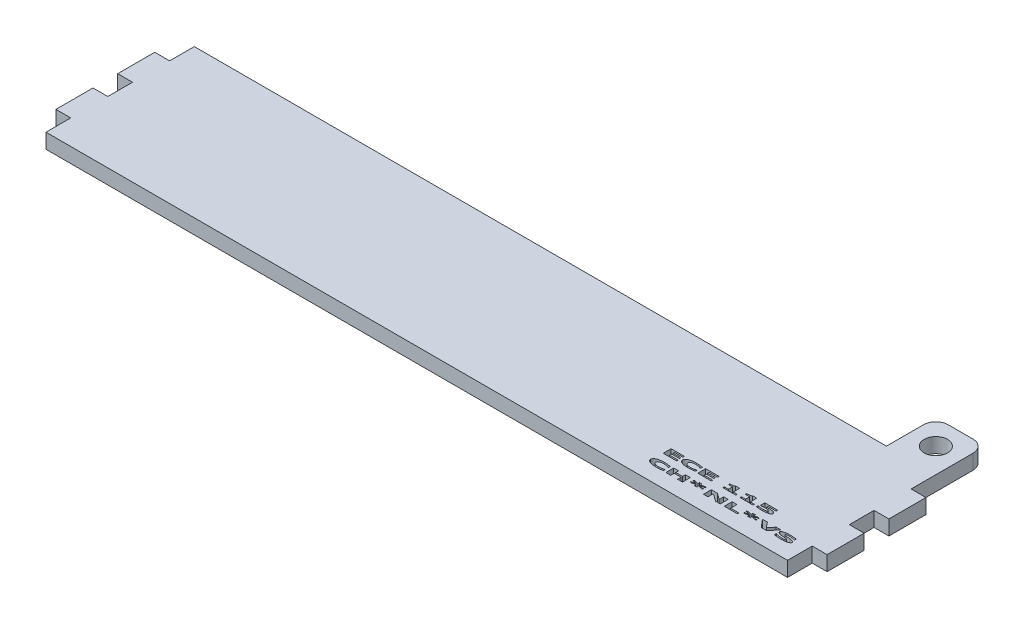
from build123d import *

# Parameters (mm, degrees)
BOSS_EXTRUDE1_DEPTH = 6
SKETCH2_R           = 4.75
CUT_EXTRUDE1_DEPTH  = 6
FILLET2_R           = 5
CUT_EXTRUDE2_DEPTH  = 10


with BuildPart() as part:
    # Sketch1 → Boss-Extrude1 (new body)
    with BuildSketch(Plane(origin=(0, 0, 0), x_dir=(1, 0, 0), z_dir=(0, 1, 0))):
        Polygon((-153.92896215, 40.606901786), (-153.92896215, 30.606901786), (-159.92896215, 30.606901786), (-159.92896215, 15.606901786), (-153.92896215, 15.606901786), (-153.92896215, 5.606901786), (146.07103785, 5.606901786), (146.07103785, 15.606901786), (152.07103785, 15.606901786), (152.07103785, 30.606901786), (146.07103785, 30.606901786), (146.07103785, 40.606901786), (152.07103785, 40.606901786), (152.07103785, 55.606901786), (146.07103785, 55.606901786), (146.07103785, 65.606901786), (146.07103785, 85.606901786), (126.07103785, 85.606901786), (126.07103785, 65.606901786), (-153.92896215, 65.606901786), (-153.92896215, 55.606901786), (-159.92896215, 55.606901786), (-159.92896215, 40.606901786), align=None)
    extrude(amount=BOSS_EXTRUDE1_DEPTH)

    # Sketch2 → Cut-Extrude1 (cut)
    with BuildSketch(Plane(origin=(0, 6, 0), x_dir=(1, 0, 0), z_dir=(0, 1, 0))):
        with Locations(Location((136.07103785, 75.606901786, 0), (0, 0, 270))):
            Circle(SKETCH2_R)
    extrude(amount=-CUT_EXTRUDE1_DEPTH, mode=Mode.SUBTRACT)

    # Fillet2
    fillet2_edges = [part.edges().sort_by_distance(p)[0] for p in [
        (126.07103785, 3, -85.606901786),
        (146.07103785, 3, -85.606901786),
    ]]
    fillet(fillet2_edges, radius=FILLET2_R)

    # Sketch3 → Cut-Extrude2 (cut)
    with BuildSketch(Plane(origin=(0, 6, 0), x_dir=(1, 0, 0), z_dir=(0, 1, 0))):
        Polygon((83.42530961, 17.980400231), (83.42530961, 21.155400231), (88.810752648, 21.155400231), (88.810752648, 20.55255213), (85.394613407, 20.55255213), (85.394613407, 19.989893902), (88.529423534, 19.989893902), (88.529423534, 19.387045801), (85.394613407, 19.387045801), (85.394613407, 18.583248332), (88.810752648, 18.583248332), (88.810752648, 17.980400231), align=None)
        with BuildLine():
            add(Edge.make_bspline(
                [(93.56508908, 17.900020484), (93.492032584, 17.900417104), (93.347577238, 17.901201344), (93.133835051, 17.906378065), (92.92572014, 17.914296538), (92.72346776, 17.926185585), (92.52689928, 17.941978389), (92.335964702, 17.960804822), (92.150810238, 17.982452143), (91.971437632, 18.008468815), (91.797640553, 18.037239388), (91.629401171, 18.068993922), (91.467102592, 18.104814393), (91.310738041, 18.144448428), (91.15995553, 18.187126322), (91.014667148, 18.232739881), (90.875288076, 18.282500103), (90.741753044, 18.334979434), (90.615126947, 18.390309949), (90.49681384, 18.449776596), (90.386285981, 18.510849879), (90.283940424, 18.575178228), (90.189831499, 18.642306971), (90.10324818, 18.711722061), (90.025974454, 18.785156197), (89.955816557, 18.860107458), (89.894662605, 18.938737816), (89.840674297, 19.019545742), (89.796586683, 19.1041721), (89.758577548, 19.190448423), (89.730742992, 19.280338319), (89.709624045, 19.372624354), (89.697756687, 19.467955709), (89.695878183, 19.532285144), (89.694929863, 19.564760397)],
                knots=[0, 0, 0, 0, 1.526573845, 3.018509894, 4.467411971, 5.878281822, 7.251696198, 8.587843696, 9.887216291, 11.146632639, 12.374816608, 13.56807849, 14.723776847, 15.847216084, 16.938292852, 17.99793299, 19.028605349, 20.030092923, 20.995592904, 21.914960519, 22.796075057, 23.633414376, 24.439330489, 25.210565447, 25.950077819, 26.665072316, 27.353678323, 28.029397375, 28.692700339, 29.345141502, 29.996687694, 30.655664519, 31.32134278, 32, 32, 32, 32], degree=3))
            add(Edge.make_bspline(
                [(89.694929863, 19.564760397), (89.695879725, 19.596189598), (89.697760901, 19.658434303), (89.709601664, 19.750650483), (89.730930034, 19.840163776), (89.758631633, 19.927770906), (89.796418245, 20.012413426), (89.841737693, 20.094642117), (89.894637562, 20.175000906), (89.95656785, 20.252224425), (90.026759923, 20.327051433), (90.104469709, 20.400037995), (90.191232525, 20.469629543), (90.285412324, 20.537558409), (90.388041592, 20.602784369), (90.498760344, 20.665530061), (90.617602551, 20.72581695), (90.744365274, 20.783085647), (90.877612592, 20.838776277), (91.017919995, 20.88864789), (91.162964757, 20.937932538), (91.314344131, 20.981109843), (91.471110997, 21.022161972), (91.633494408, 21.060019506), (91.802027223, 21.092892353), (91.975821127, 21.122915602), (92.155140399, 21.150393693), (92.340361083, 21.172437917), (92.531492702, 21.19199551), (92.728278053, 21.208340836), (92.930737838, 21.220845602), (93.138843673, 21.229605104), (93.352602683, 21.234551581), (93.497056893, 21.235367392), (93.570112814, 21.235779978)],
                knots=[0, 0, 0, 0, 0.65753733, 1.302235383, 1.940597184, 2.580354149, 3.221473336, 3.876029549, 4.542775398, 5.231420034, 5.943997625, 6.687520193, 7.459608777, 8.26896764, 9.115620662, 10.002003933, 10.930240788, 11.902180298, 12.911333695, 13.950230461, 15.016452108, 16.115360642, 17.242223418, 18.406371194, 19.602621935, 20.8336303, 22.09571741, 23.397051357, 24.735114871, 26.114768781, 27.527464917, 28.978149127, 30.471736497, 32, 32, 32, 32], degree=3))
            add(Edge.make_bspline(
                [(93.570112814, 21.235779978), (93.646935278, 21.235535143), (93.796612767, 21.235058118), (94.014966733, 21.231474298), (94.221377204, 21.224506289), (94.478100763, 21.211962506), (94.783984811, 21.191759627), (95.024330508, 21.167766323), (95.141913645, 21.156028198)],
                knots=[0, 0, 0, 0, 0.878193669, 1.711033665, 2.496333889, 3.238989211, 4.649244345, 6, 6, 6, 6], degree=3))
            add(Edge.make_bspline(
                [(95.141913645, 21.156028198), (95.187983792, 21.150528283), (95.28231998, 21.139266304), (95.426552976, 21.119076605), (95.576783979, 21.095582224), (95.72940507, 21.070571145), (95.877515422, 21.044495013), (96.013843648, 21.020323835), (96.135026069, 20.997608263), (96.210513356, 20.982758748), (96.24587923, 20.975801734)],
                knots=[0, 0, 0, 0, 0.995233725, 2.037904432, 3.123822184, 4.256912348, 5.355336461, 6.349719005, 7.226841613, 8, 8, 8, 8], degree=3))
            Line((96.24587923, 20.975801734), (96.24587923, 20.231033143))
            Line((96.24587923, 20.231033143), (96.044301896, 20.231033143))
            add(Edge.make_bspline(
                [(96.044301896, 20.231033143), (96.018969099, 20.23939058), (95.964971709, 20.257204633), (95.879641459, 20.285723009), (95.784221063, 20.314644706), (95.68080974, 20.347798937), (95.568572991, 20.380806505), (95.448890943, 20.414129646), (95.321739098, 20.44671376), (95.234462245, 20.467682864), (95.189639119, 20.478452051)],
                knots=[0, 0, 0, 0, 0.719263266, 1.53312479, 2.425686688, 3.407470709, 4.461087999, 5.579810858, 6.757053697, 8, 8, 8, 8], degree=3))
            add(Edge.make_bspline(
                [(95.189639119, 20.478452051), (95.142585351, 20.488912859), (95.046199622, 20.510340955), (94.897808849, 20.539211833), (94.742111479, 20.564606162), (94.580385464, 20.588586881), (94.413193321, 20.609242581), (94.241774154, 20.622300813), (94.066734632, 20.631909038), (93.948790692, 20.632588248), (93.889119934, 20.632931877)],
                knots=[0, 0, 0, 0, 0.881419965, 1.805515453, 2.763895106, 3.765884147, 4.795195207, 5.843546214, 6.908996661, 8, 8, 8, 8], degree=3))
            add(Edge.make_bspline(
                [(93.889119934, 20.632931877), (93.818980208, 20.632480106), (93.681545278, 20.631594887), (93.47987597, 20.620226141), (93.286853895, 20.603948401), (93.101992097, 20.579420447), (92.923902277, 20.546932394), (92.751017409, 20.50477097), (92.582435396, 20.452432687), (92.473423778, 20.409040513), (92.419049721, 20.387396869)],
                knots=[0, 0, 0, 0, 1.121726428, 2.197961131, 3.229784328, 4.219419097, 5.179490737, 6.123888198, 7.064211564, 8, 8, 8, 8], degree=3))
            add(Edge.make_bspline(
                [(92.419049721, 20.387396869), (92.371231296, 20.36622995), (92.277780482, 20.324863763), (92.148712652, 20.246666016), (92.033170927, 20.157920555), (91.947853063, 20.074985398), (91.888484522, 20.003462167), (91.850051767, 19.947327293), (91.817234165, 19.88899725), (91.790770763, 19.828126383), (91.76974311, 19.765156744), (91.755576791, 19.699436278), (91.746500776, 19.631577515), (91.745246727, 19.585512354), (91.744613407, 19.56224853)],
                knots=[0, 0, 0, 0, 1.658984506, 3.242128014, 4.777469857, 6.276641552, 7.008449897, 7.725534309, 8.433662369, 9.130060592, 9.8299069, 10.537785421, 11.261552506, 12, 12, 12, 12], degree=3))
            add(Edge.make_bspline(
                [(91.744613407, 19.56224853), (91.745176504, 19.537722986), (91.74628295, 19.489531977), (91.756186104, 19.418971163), (91.77092952, 19.35136279), (91.792569168, 19.28681505), (91.820180324, 19.225102109), (91.854265198, 19.166362019), (91.894911695, 19.110995857), (91.956595627, 19.04002103), (92.047070216, 18.959264313), (92.169236126, 18.872375179), (92.306040814, 18.794379589), (92.40516253, 18.752810335), (92.45609976, 18.731448491)],
                knots=[0, 0, 0, 0, 0.754971008, 1.483466125, 2.190419455, 2.883569281, 3.576119238, 4.269418951, 4.9709131, 5.688370645, 7.162391168, 8.691982447, 10.300057168, 12, 12, 12, 12], degree=3))
            add(Edge.make_bspline(
                [(92.45609976, 18.731448491), (92.508598184, 18.711855287), (92.615560192, 18.671935452), (92.783596016, 18.625337792), (92.96001189, 18.585463978), (93.143939471, 18.554604966), (93.332431561, 18.53214257), (93.521926129, 18.514960259), (93.711078167, 18.504576699), (93.836986159, 18.503437083), (93.899795369, 18.502868586)],
                knots=[0, 0, 0, 0, 0.914705363, 1.863650653, 2.844708193, 3.867494131, 4.90754541, 5.943995276, 6.974361893, 8, 8, 8, 8], degree=3))
            add(Edge.make_bspline(
                [(93.899795369, 18.502868586), (93.964489528, 18.503433654), (94.092272861, 18.504549772), (94.281570752, 18.514564869), (94.466397899, 18.5289661), (94.644916234, 18.551232515), (94.814290056, 18.577318943), (94.971524535, 18.602896992), (95.114736943, 18.631178732), (95.204972913, 18.652294282), (95.248040029, 18.662372146)],
                knots=[0, 0, 0, 0, 1.141006631, 2.253706237, 3.34279284, 4.410274429, 5.425868972, 6.365469008, 7.219883877, 8, 8, 8, 8], degree=3))
            add(Edge.make_bspline(
                [(95.248040029, 18.662372146), (95.290994908, 18.672662516), (95.374587073, 18.692688048), (95.495344695, 18.724692003), (95.608162958, 18.756809269), (95.713016731, 18.788750583), (95.810460025, 18.820708255), (95.901537602, 18.849728771), (95.985596976, 18.878468213), (96.039680224, 18.896235087), (96.065652767, 18.90476732)],
                knots=[0, 0, 0, 0, 1.242492788, 2.417947971, 3.513904658, 4.542088145, 5.501090356, 6.398630547, 7.23097008, 8, 8, 8, 8], degree=3))
            Line((96.065652767, 18.90476732), (96.24587923, 18.90476732))
            Line((96.24587923, 18.90476732), (96.24587923, 18.168790263))
            add(Edge.make_bspline(
                [(96.24587923, 18.168790263), (96.208204701, 18.161863554), (96.129946276, 18.147475231), (96.008124284, 18.125474466), (95.877426049, 18.102478019), (95.691077739, 18.068379014), (95.448900618, 18.027616668), (95.252117775, 18.002932461), (95.15258908, 17.9904477)],
                knots=[0, 0, 0, 0, 0.622328667, 1.29271585, 2.011166193, 2.778279186, 4.370520189, 6, 6, 6, 6], degree=3))
            add(Edge.make_bspline(
                [(95.15258908, 17.9904477), (95.091689352, 17.983425526), (94.971839988, 17.969606039), (94.794986504, 17.951200632), (94.623888923, 17.936487235), (94.483653976, 17.925015671), (94.369569096, 17.917049464), (94.276993959, 17.913197621), (94.176971642, 17.908336308), (94.069144492, 17.905527304), (93.954017267, 17.903023343), (93.831144929, 17.900922896), (93.700729204, 17.900721123), (93.611139721, 17.900258355), (93.56508908, 17.900020484)],
                knots=[0, 0, 0, 0, 1.386885664, 2.729361349, 4.022442864, 5.271863776, 5.912585845, 6.609504562, 7.367921761, 8.178051617, 9.049603758, 9.973150659, 10.958162174, 12, 12, 12, 12], degree=3))
        make_face()
        Polygon((97.411385559, 17.980400231), (97.411385559, 21.155400231), (102.796828597, 21.155400231), (102.796828597, 20.55255213), (99.380689357, 20.55255213), (99.380689357, 19.989893902), (102.515499483, 19.989893902), (102.515499483, 19.387045801), (99.380689357, 19.387045801), (99.380689357, 18.583248332), (102.796828597, 18.583248332), (102.796828597, 17.980400231), align=None)
        with BuildLine():
            Line((112.804107078, 17.980400231), (107.53923366, 17.980400231))
            Line((107.53923366, 17.980400231), (107.53923366, 18.543058459))
            Line((107.53923366, 18.543058459), (109.227208344, 18.543058459))
            Line((109.227208344, 18.543058459), (109.227208344, 20.190843269))
            Line((109.227208344, 20.190843269), (107.53923366, 20.190843269))
            Line((107.53923366, 20.190843269), (107.53923366, 20.713311624))
            add(Edge.make_bspline(
                [(107.53923366, 20.713311624), (107.662328698, 20.714338045), (107.907555685, 20.716382858), (108.210688681, 20.728457869), (108.442447654, 20.7426708), (108.597960492, 20.757493705), (108.735435204, 20.773064929), (108.820353025, 20.788857984), (108.859847782, 20.796203238)],
                knots=[0, 0, 0, 0, 1.672447792, 3.331810438, 4.121269888, 4.826785681, 5.454345225, 6, 6, 6, 6], degree=3))
            add(Edge.make_bspline(
                [(108.859847782, 20.796203238), (108.900581697, 20.805090826), (108.977873051, 20.821954753), (109.085716106, 20.854063591), (109.178549298, 20.892115952), (109.258284176, 20.932523276), (109.322826652, 20.980091495), (109.373136127, 21.032357174), (109.408701378, 21.091172932), (109.418760791, 21.134072312), (109.423761944, 21.155400231)],
                knots=[0, 0, 0, 0, 1.413494418, 2.682062307, 3.808974498, 4.812251547, 5.70514132, 6.513552809, 7.260995743, 8, 8, 8, 8], degree=3))
            Line((109.423761944, 21.155400231), (111.156322268, 21.155400231))
            Line((111.156322268, 21.155400231), (111.156322268, 18.543058459))
            Line((111.156322268, 18.543058459), (112.804107078, 18.543058459))
            Line((112.804107078, 18.543058459), (112.804107078, 17.980400231))
        make_face()
        with BuildLine():
            Line((119.716765306, 17.980400231), (114.451891888, 17.980400231))
            Line((114.451891888, 17.980400231), (114.451891888, 18.543058459))
            Line((114.451891888, 18.543058459), (116.139866572, 18.543058459))
            Line((116.139866572, 18.543058459), (116.139866572, 20.190843269))
            Line((116.139866572, 20.190843269), (114.451891888, 20.190843269))
            Line((114.451891888, 20.190843269), (114.451891888, 20.713311624))
            add(Edge.make_bspline(
                [(114.451891888, 20.713311624), (114.574986926, 20.714338045), (114.820213913, 20.716382858), (115.123346909, 20.728457869), (115.355105882, 20.7426708), (115.51061872, 20.757493705), (115.648093432, 20.773064929), (115.733011253, 20.788857984), (115.77250601, 20.796203238)],
                knots=[0, 0, 0, 0, 1.672447792, 3.331810438, 4.121269888, 4.826785681, 5.454345225, 6, 6, 6, 6], degree=3))
            add(Edge.make_bspline(
                [(115.77250601, 20.796203238), (115.813239925, 20.805090826), (115.890531279, 20.821954753), (115.998374334, 20.854063591), (116.091207526, 20.892115952), (116.170942404, 20.932523276), (116.23548488, 20.980091495), (116.285794355, 21.032357174), (116.321359606, 21.091172932), (116.331419019, 21.134072312), (116.336420172, 21.155400231)],
                knots=[0, 0, 0, 0, 1.413494418, 2.682062307, 3.808974498, 4.812251547, 5.70514132, 6.513552809, 7.260995743, 8, 8, 8, 8], degree=3))
            Line((116.336420172, 21.155400231), (118.068980496, 21.155400231))
            Line((118.068980496, 21.155400231), (118.068980496, 18.543058459))
            Line((118.068980496, 18.543058459), (119.716765306, 18.543058459))
            Line((119.716765306, 18.543058459), (119.716765306, 17.980400231))
        make_face()
        with BuildLine():
            add(Edge.make_bspline(
                [(126.790183028, 19.044175943), (126.789647, 19.023616565), (126.788579334, 18.982666106), (126.777869577, 18.922098625), (126.761791278, 18.862583464), (126.737938351, 18.804558291), (126.708567634, 18.747104336), (126.671700977, 18.691280869), (126.62886651, 18.636270503), (126.578902133, 18.583109852), (126.52300121, 18.530686377), (126.4599306, 18.480729956), (126.390643657, 18.432084346), (126.314321933, 18.386059817), (126.232198878, 18.340361683), (126.142596884, 18.298314284), (126.047170997, 18.256339195), (125.980444742, 18.231268071), (125.946195686, 18.218399638)],
                knots=[0, 0, 0, 0, 0.784819256, 1.563214012, 2.343250607, 3.136339881, 3.955496228, 4.805126228, 5.688275964, 6.616383635, 7.589705738, 8.613943966, 9.687846522, 10.822232017, 12.017786126, 13.277000871, 14.602347028, 16, 16, 16, 16], degree=3))
            add(Edge.make_bspline(
                [(125.946195686, 18.218399638), (125.910695746, 18.20579607), (125.838630339, 18.18021064), (125.726860399, 18.145890131), (125.610492634, 18.113223344), (125.488951709, 18.083214502), (125.362689628, 18.055009256), (125.231478545, 18.028468881), (125.095084307, 18.004918453), (124.95342083, 17.982647641), (124.805175429, 17.963199948), (124.649190744, 17.946261062), (124.485033303, 17.932042607), (124.312549356, 17.919829404), (124.131829219, 17.911641581), (123.942615221, 17.904279626), (123.745185576, 17.900779516), (123.610788171, 17.900276615), (123.542338882, 17.900020484)],
                knots=[0, 0, 0, 0, 0.742004439, 1.506280103, 2.302651752, 3.122722064, 3.972053931, 4.851085412, 5.759491307, 6.698426798, 7.67583377, 8.704493512, 9.788993823, 10.921533901, 12.11049155, 13.35248036, 14.651604636, 16, 16, 16, 16], degree=3))
            add(Edge.make_bspline(
                [(123.542338882, 17.900020484), (123.469702835, 17.900296492), (123.327145304, 17.900838191), (123.117186019, 17.904063917), (122.914966184, 17.908955238), (122.720303152, 17.916073055), (122.533347036, 17.923947607), (122.354153404, 17.934034585), (122.182903122, 17.945850646), (122.019424562, 17.959694581), (121.863346878, 17.975191166), (121.714245707, 17.989878543), (121.571917438, 18.005738539), (121.436658911, 18.021835504), (121.308399821, 18.03904772), (121.186927898, 18.055788957), (121.072447496, 18.073354173), (120.998434218, 18.085620169), (120.962651382, 18.09155035)],
                knots=[0, 0, 0, 0, 1.346278971, 2.642244644, 3.891894204, 5.095358767, 6.252609571, 7.360065745, 8.421786456, 9.434113654, 10.400774722, 11.3288267, 12.210987683, 13.055052507, 13.853413744, 14.609487944, 15.327735959, 16, 16, 16, 16], degree=3))
            Line((120.962651382, 18.09155035), (120.962651382, 18.7841977))
            Line((120.962651382, 18.7841977), (121.144133779, 18.7841977))
            add(Edge.make_bspline(
                [(121.144133779, 18.7841977), (121.169883907, 18.778142114), (121.222866053, 18.76568245), (121.304493909, 18.746181135), (121.390737752, 18.725472136), (121.483234945, 18.70271106), (121.585768827, 18.679850061), (121.70129698, 18.656587338), (121.831653482, 18.633712781), (121.923429708, 18.618347897), (121.971793985, 18.610250904)],
                knots=[0, 0, 0, 0, 0.750369543, 1.543921971, 2.380661898, 3.266364147, 4.245950816, 5.36036913, 6.608966131, 8, 8, 8, 8], degree=3))
            add(Edge.make_bspline(
                [(121.971793985, 18.610250904), (122.066747627, 18.595475129), (122.25752615, 18.565788006), (122.499130749, 18.536647701), (122.698186855, 18.518853505), (122.856295459, 18.509630084), (123.022548445, 18.503883288), (123.136248786, 18.503212118), (123.19444529, 18.502868586)],
                knots=[0, 0, 0, 0, 1.40754061, 2.827996003, 3.563619146, 4.334585276, 5.147572351, 6, 6, 6, 6], degree=3))
            add(Edge.make_bspline(
                [(123.19444529, 18.502868586), (123.247198219, 18.503262719), (123.354616709, 18.504065277), (123.518580683, 18.509732524), (123.688318861, 18.520288031), (123.832552826, 18.530813659), (123.947921681, 18.541234097), (124.030860356, 18.551222094), (124.109536314, 18.563331308), (124.183900793, 18.576332321), (124.254133628, 18.590688221), (124.319641247, 18.60702484), (124.381168674, 18.624392688), (124.420090795, 18.638102153), (124.439075433, 18.644789076)],
                knots=[0, 0, 0, 0, 1.509913997, 3.074572098, 4.695060299, 6.377335178, 7.213759817, 8.010399669, 8.76791391, 9.491894745, 10.171055311, 10.819140934, 11.424024673, 12, 12, 12, 12], degree=3))
            add(Edge.make_bspline(
                [(124.439075433, 18.644789076), (124.464581324, 18.65527945), (124.513214697, 18.675281978), (124.580287364, 18.710193851), (124.638850205, 18.746442979), (124.689654171, 18.784386099), (124.730603902, 18.827760525), (124.760447403, 18.877881675), (124.777774373, 18.935476621), (124.779693227, 18.976027412), (124.780689357, 18.997078435)],
                knots=[0, 0, 0, 0, 1.258491639, 2.399629651, 3.446972619, 4.400726792, 5.286526613, 6.151833398, 7.040566254, 8, 8, 8, 8], degree=3))
            add(Edge.make_bspline(
                [(124.780689357, 18.997078435), (124.779402491, 19.014878943), (124.776809185, 19.050750723), (124.753790627, 19.101843784), (124.716445487, 19.148015462), (124.665300069, 19.188728995), (124.603524537, 19.225638074), (124.532976922, 19.26051939), (124.453044306, 19.290235548), (124.396285258, 19.306432513), (124.366859254, 19.314829622)],
                knots=[0, 0, 0, 0, 0.76331887, 1.538248621, 2.365667786, 3.300126078, 4.335476306, 5.459731454, 6.683030218, 8, 8, 8, 8], degree=3))
            add(Edge.make_bspline(
                [(124.366859254, 19.314829622), (124.319465425, 19.326301888), (124.220681296, 19.350213815), (124.063666326, 19.375640065), (123.893141618, 19.39588529), (123.713256704, 19.407747957), (123.533378009, 19.416013395), (123.362354074, 19.422389874), (123.204303022, 19.426421277), (123.103392229, 19.426971846), (123.055036667, 19.427235674)],
                knots=[0, 0, 0, 0, 0.886476295, 1.847704474, 2.890235779, 4.008425631, 5.125026937, 6.164921059, 7.120646353, 8, 8, 8, 8], degree=3))
            add(Edge.make_bspline(
                [(123.055036667, 19.427235674), (122.911831072, 19.42622451), (122.629261514, 19.424229306), (122.28061932, 19.406151785), (122.013571981, 19.389773444), (121.828383629, 19.375432665), (121.656880174, 19.36217347), (121.54706694, 19.351812135), (121.494539238, 19.346855927)],
                knots=[0, 0, 0, 0, 1.648911322, 3.253588981, 4.019215026, 4.729863207, 5.392446933, 6, 6, 6, 6], degree=3))
            Line((121.494539238, 19.346855927), (121.324360243, 19.346855927))
            Line((121.324360243, 19.346855927), (121.324360243, 21.155400231))
            Line((121.324360243, 21.155400231), (126.58923366, 21.155400231))
            Line((126.58923366, 21.155400231), (126.58923366, 20.55255213))
            Line((126.58923366, 20.55255213), (123.213284293, 20.55255213))
            Line((123.213284293, 20.55255213), (123.213284293, 20.01940834))
            add(Edge.make_bspline(
                [(123.213284293, 20.01940834), (123.241125652, 20.019969932), (123.299324196, 20.021143863), (123.390351685, 20.02434198), (123.488970162, 20.024761384), (123.591940938, 20.027212541), (123.692634956, 20.028008946), (123.784312014, 20.029516795), (123.863647498, 20.030193492), (123.912420564, 20.030118303), (123.934818115, 20.030083775)],
                knots=[0, 0, 0, 0, 0.926130765, 1.935949454, 3.029012228, 4.205711097, 5.361423629, 6.37791528, 7.255106828, 8, 8, 8, 8], degree=3))
            add(Edge.make_bspline(
                [(123.934818115, 20.030083775), (124.027761788, 20.029381356), (124.210126228, 20.02800314), (124.478368497, 20.020126401), (124.735892457, 20.005516485), (124.982215933, 19.985968527), (125.216316332, 19.959461604), (125.43703384, 19.928134056), (125.643907128, 19.889539388), (125.775934674, 19.857336732), (125.840069301, 19.841693744)],
                knots=[0, 0, 0, 0, 1.162247236, 2.280441012, 3.355306573, 4.387391666, 5.369892039, 6.300875277, 7.174621243, 8, 8, 8, 8], degree=3))
            add(Edge.make_bspline(
                [(125.840069301, 19.841693744), (125.876769949, 19.831680421), (125.948215539, 19.812187367), (126.051858119, 19.779534512), (126.149013007, 19.743735145), (126.240130909, 19.705749137), (126.324391942, 19.664660459), (126.402905632, 19.622046959), (126.47494983, 19.57642791), (126.540542148, 19.528066221), (126.599130612, 19.477256619), (126.650694352, 19.423938394), (126.693197973, 19.367016477), (126.729459586, 19.308199566), (126.756053229, 19.245775255), (126.775837015, 19.18098776), (126.788233293, 19.113516583), (126.789528231, 19.067463242), (126.790183028, 19.044175943)],
                knots=[0, 0, 0, 0, 1.365956372, 2.659123616, 3.900442203, 5.082833826, 6.202270166, 7.265247093, 8.289076539, 9.261714949, 10.18870153, 11.071228481, 11.919081694, 12.735050645, 13.546332575, 14.347629655, 15.164463622, 16, 16, 16, 16], degree=3))
        make_face()
        with BuildLine():
            add(Edge.make_bspline(
                [(86.853380219, 11.67533694), (86.780323724, 11.67573356), (86.635868377, 11.6765178), (86.42212619, 11.681694521), (86.214011279, 11.689612994), (86.011758899, 11.701502041), (85.815190419, 11.717294845), (85.624255841, 11.736121278), (85.439101378, 11.757768599), (85.259728771, 11.78378527), (85.085931692, 11.812555844), (84.91769231, 11.844310378), (84.755393731, 11.880130849), (84.59902918, 11.919764884), (84.448246669, 11.962442777), (84.302958287, 12.008056336), (84.163579215, 12.057816559), (84.030044184, 12.11029589), (83.903418086, 12.165626405), (83.785104979, 12.225093052), (83.67457712, 12.286166335), (83.572231563, 12.350494684), (83.478122638, 12.417623427), (83.39153932, 12.487038517), (83.314265594, 12.560472653), (83.244107696, 12.635423913), (83.182953744, 12.714054272), (83.128965436, 12.794862198), (83.084877822, 12.879488556), (83.046868687, 12.965764879), (83.019034131, 13.055654775), (82.997915184, 13.14794081), (82.986047827, 13.243272164), (82.984169322, 13.307601599), (82.983221002, 13.340076853)],
                knots=[0, 0, 0, 0, 1.526573845, 3.018509894, 4.467411971, 5.878281822, 7.251696198, 8.587843696, 9.887216291, 11.146632639, 12.374816608, 13.56807849, 14.723776847, 15.847216084, 16.938292852, 17.99793299, 19.028605349, 20.030092923, 20.995592904, 21.914960519, 22.796075057, 23.633414376, 24.439330489, 25.210565447, 25.950077819, 26.665072316, 27.353678323, 28.029397375, 28.692700339, 29.345141502, 29.996687694, 30.655664519, 31.32134278, 32, 32, 32, 32], degree=3))
            add(Edge.make_bspline(
                [(82.983221002, 13.340076853), (82.984170864, 13.371506054), (82.98605204, 13.433750759), (82.997892803, 13.525966939), (83.019221173, 13.615480231), (83.046922772, 13.703087362), (83.084709384, 13.787729881), (83.130028832, 13.869958573), (83.182928701, 13.950317362), (83.244858989, 14.027540881), (83.315051062, 14.102367889), (83.392760848, 14.175354451), (83.479523664, 14.244945999), (83.573703463, 14.312874864), (83.676332731, 14.378100824), (83.787051484, 14.440846517), (83.90589369, 14.501133406), (84.032656413, 14.558402103), (84.165903731, 14.614092733), (84.306211135, 14.663964345), (84.451255896, 14.713248994), (84.60263527, 14.756426298), (84.759402136, 14.797478428), (84.921785547, 14.835335961), (85.090318363, 14.868208809), (85.264112266, 14.898232058), (85.443431538, 14.925710149), (85.628652222, 14.947754373), (85.819783841, 14.967311966), (86.016569192, 14.983657292), (86.219028977, 14.996162057), (86.427134812, 15.00492156), (86.640893822, 15.009868037), (86.785348033, 15.010683848), (86.858403953, 15.011096434)],
                knots=[0, 0, 0, 0, 0.65753733, 1.302235383, 1.940597184, 2.580354149, 3.221473336, 3.876029549, 4.542775398, 5.231420034, 5.943997625, 6.687520193, 7.459608777, 8.26896764, 9.115620662, 10.002003933, 10.930240788, 11.902180298, 12.911333695, 13.950230461, 15.016452108, 16.115360642, 17.242223418, 18.406371194, 19.602621935, 20.8336303, 22.09571741, 23.397051357, 24.735114871, 26.114768781, 27.527464917, 28.978149127, 30.471736497, 32, 32, 32, 32], degree=3))
            add(Edge.make_bspline(
                [(86.858403953, 15.011096434), (86.935226418, 15.010851599), (87.084903906, 15.010374573), (87.303257872, 15.006790754), (87.509668344, 14.999822745), (87.766391903, 14.987278962), (88.07227595, 14.967076083), (88.312621647, 14.943082779), (88.430204784, 14.931344654)],
                knots=[0, 0, 0, 0, 0.878193669, 1.711033665, 2.496333889, 3.238989211, 4.649244345, 6, 6, 6, 6], degree=3))
            add(Edge.make_bspline(
                [(88.430204784, 14.931344654), (88.476274931, 14.925844739), (88.570611119, 14.914582759), (88.714844115, 14.894393061), (88.865075118, 14.87089868), (89.01769621, 14.845887601), (89.165806561, 14.819811468), (89.302134787, 14.795640291), (89.423317209, 14.772924719), (89.498804496, 14.758075203), (89.534170369, 14.75111819)],
                knots=[0, 0, 0, 0, 0.995233725, 2.037904432, 3.123822184, 4.256912348, 5.355336461, 6.349719005, 7.226841613, 8, 8, 8, 8], degree=3))
            Line((89.534170369, 14.75111819), (89.534170369, 14.006349598))
            Line((89.534170369, 14.006349598), (89.332593035, 14.006349598))
            add(Edge.make_bspline(
                [(89.332593035, 14.006349598), (89.307260238, 14.014707035), (89.253262848, 14.032521089), (89.167932598, 14.061039464), (89.072512202, 14.089961162), (88.96910088, 14.123115393), (88.856864131, 14.156122961), (88.737182082, 14.189446101), (88.610030237, 14.222030216), (88.522753384, 14.242999319), (88.477930259, 14.253768506)],
                knots=[0, 0, 0, 0, 0.719263266, 1.53312479, 2.425686688, 3.407470709, 4.461087999, 5.579810858, 6.757053697, 8, 8, 8, 8], degree=3))
            add(Edge.make_bspline(
                [(88.477930259, 14.253768506), (88.43087649, 14.264229315), (88.334490761, 14.285657411), (88.186099988, 14.314528289), (88.030402618, 14.339922618), (87.868676603, 14.363903337), (87.70148446, 14.384559037), (87.530065293, 14.397617269), (87.355025771, 14.407225494), (87.237081831, 14.407904704), (87.177411073, 14.408248332)],
                knots=[0, 0, 0, 0, 0.881419965, 1.805515453, 2.763895106, 3.765884147, 4.795195207, 5.843546214, 6.908996661, 8, 8, 8, 8], degree=3))
            add(Edge.make_bspline(
                [(87.177411073, 14.408248332), (87.107271347, 14.407796562), (86.969836417, 14.406911343), (86.76816711, 14.395542597), (86.575145035, 14.379264857), (86.390283236, 14.354736903), (86.212193416, 14.32224885), (86.039308549, 14.280087426), (85.870726535, 14.227749143), (85.761714918, 14.184356968), (85.70734086, 14.162713325)],
                knots=[0, 0, 0, 0, 1.121726428, 2.197961131, 3.229784328, 4.219419097, 5.179490737, 6.123888198, 7.064211564, 8, 8, 8, 8], degree=3))
            add(Edge.make_bspline(
                [(85.70734086, 14.162713325), (85.659522436, 14.141546405), (85.566071621, 14.100180219), (85.437003792, 14.021982472), (85.321462066, 13.93323701), (85.236144202, 13.850301854), (85.176775662, 13.778778623), (85.138342906, 13.722643749), (85.105525304, 13.664313706), (85.079061902, 13.603442839), (85.058034249, 13.5404732), (85.04386793, 13.474752734), (85.034791915, 13.40689397), (85.033537866, 13.36082881), (85.032904547, 13.337564986)],
                knots=[0, 0, 0, 0, 1.658984506, 3.242128014, 4.777469857, 6.276641552, 7.008449897, 7.725534309, 8.433662369, 9.130060592, 9.8299069, 10.537785421, 11.261552506, 12, 12, 12, 12], degree=3))
            add(Edge.make_bspline(
                [(85.032904547, 13.337564986), (85.033467643, 13.313039441), (85.034574089, 13.264848433), (85.044477243, 13.194287619), (85.059220659, 13.126679245), (85.080860307, 13.062131506), (85.108471464, 13.000418565), (85.142556338, 12.941678474), (85.183202835, 12.886312313), (85.244886767, 12.815337485), (85.335361355, 12.734580769), (85.457527265, 12.647691635), (85.594331953, 12.569696045), (85.693453669, 12.528126791), (85.744390899, 12.506764946)],
                knots=[0, 0, 0, 0, 0.754971008, 1.483466125, 2.190419455, 2.883569281, 3.576119238, 4.269418951, 4.9709131, 5.688370645, 7.162391168, 8.691982447, 10.300057168, 12, 12, 12, 12], degree=3))
            add(Edge.make_bspline(
                [(85.744390899, 12.506764946), (85.796889323, 12.487171743), (85.903851331, 12.447251908), (86.071887155, 12.400654248), (86.248303029, 12.360780434), (86.43223061, 12.329921421), (86.620722701, 12.307459026), (86.810217268, 12.290276714), (86.999369306, 12.279893155), (87.125277298, 12.278753539), (87.188086509, 12.278185041)],
                knots=[0, 0, 0, 0, 0.914705363, 1.863650653, 2.844708193, 3.867494131, 4.90754541, 5.943995276, 6.974361893, 8, 8, 8, 8], degree=3))
            add(Edge.make_bspline(
                [(87.188086509, 12.278185041), (87.252780668, 12.27875011), (87.380564, 12.279866228), (87.569861892, 12.289881325), (87.754689039, 12.304282556), (87.933207373, 12.326548971), (88.102581195, 12.352635399), (88.259815674, 12.378213448), (88.403028082, 12.406495187), (88.493264053, 12.427610737), (88.536331168, 12.437688601)],
                knots=[0, 0, 0, 0, 1.141006631, 2.253706237, 3.34279284, 4.410274429, 5.425868972, 6.365469008, 7.219883877, 8, 8, 8, 8], degree=3))
            add(Edge.make_bspline(
                [(88.536331168, 12.437688601), (88.579286047, 12.447978972), (88.662878213, 12.468004504), (88.783635835, 12.500008458), (88.896454098, 12.532125725), (89.00130787, 12.564067039), (89.098751165, 12.596024711), (89.189828742, 12.625045227), (89.273888115, 12.653784669), (89.327971363, 12.671551542), (89.353943906, 12.680083775)],
                knots=[0, 0, 0, 0, 1.242492788, 2.417947971, 3.513904658, 4.542088145, 5.501090356, 6.398630547, 7.23097008, 8, 8, 8, 8], degree=3))
            Line((89.353943906, 12.680083775), (89.534170369, 12.680083775))
            Line((89.534170369, 12.680083775), (89.534170369, 11.944106719))
            add(Edge.make_bspline(
                [(89.534170369, 11.944106719), (89.49649584, 11.93718001), (89.418237416, 11.922791686), (89.296415423, 11.900790922), (89.165717188, 11.877794475), (88.979368879, 11.843695469), (88.737191757, 11.802933123), (88.540408914, 11.778248917), (88.440880219, 11.765764155)],
                knots=[0, 0, 0, 0, 0.622328667, 1.29271585, 2.011166193, 2.778279186, 4.370520189, 6, 6, 6, 6], degree=3))
            add(Edge.make_bspline(
                [(88.440880219, 11.765764155), (88.379980491, 11.758741982), (88.260131127, 11.744922495), (88.083277643, 11.726517088), (87.912180062, 11.71180369), (87.771945116, 11.700332127), (87.657860236, 11.69236592), (87.565285098, 11.688514077), (87.465262781, 11.683652763), (87.357435631, 11.68084376), (87.242308406, 11.678339799), (87.119436069, 11.676239352), (86.989020343, 11.676037579), (86.89943086, 11.675574811), (86.853380219, 11.67533694)],
                knots=[0, 0, 0, 0, 1.386885664, 2.729361349, 4.022442864, 5.271863776, 5.912585845, 6.609504562, 7.367921761, 8.178051617, 9.049603758, 9.973150659, 10.958162174, 12, 12, 12, 12], degree=3))
        make_face()
        Polygon((97.411385559, 11.755716687), (95.442081762, 11.755716687), (95.442081762, 13.162362256), (92.668980496, 13.162362256), (92.668980496, 11.755716687), (90.699676698, 11.755716687), (90.699676698, 14.930716687), (92.668980496, 14.930716687), (92.668980496, 13.765210358), (95.442081762, 13.765210358), (95.442081762, 14.930716687), (97.411385559, 14.930716687), align=None)
        Polygon((104.203474167, 13.569912692), (103.661538842, 13.244625904), (102.020661667, 13.701785714), (102.07843461, 12.961412889), (101.028474167, 12.961412889), (101.059872505, 13.680434844), (99.4403462, 13.242742003), (98.898410876, 13.572424559), (100.725794183, 14.006349598), (98.909086311, 14.442158538), (99.4403462, 14.769957193), (101.059872505, 14.329752486), (101.028474167, 15.051286307), (102.073410876, 15.051286307), (102.042012537, 14.329752486), (103.661538842, 14.768073293), (104.203474167, 14.440274638), (102.383626461, 14.008233499), align=None)
        Polygon((112.723727331, 11.755716687), (110.818476145, 11.755716687), (107.740183028, 13.969299559), (107.740183028, 11.755716687), (105.931638724, 11.755716687), (105.931638724, 14.930716687), (108.367521833, 14.930716687), (110.915183028, 13.112124915), (110.915183028, 14.930716687), (112.723727331, 14.930716687), align=None)
        Polygon((119.636385559, 11.755716687), (114.331322268, 11.755716687), (114.331322268, 14.930716687), (116.300626066, 14.930716687), (116.300626066, 12.358564788), (119.636385559, 12.358564788), align=None)
        Polygon((125.745246319, 13.569912692), (125.203310994, 13.244625904), (123.562433819, 13.701785714), (123.620206762, 12.961412889), (122.570246319, 12.961412889), (122.601644657, 13.680434844), (120.982118352, 13.242742003), (120.440183028, 13.572424559), (122.267566335, 14.006349598), (120.450858463, 14.442158538), (120.982118352, 14.769957193), (122.601644657, 14.329752486), (122.570246319, 15.051286307), (123.615183028, 15.051286307), (123.583784689, 14.329752486), (125.203310994, 14.768073293), (125.745246319, 14.440274638), (123.925398613, 14.008233499), align=None)
        Polygon((134.10473999, 14.930716687), (131.383131999, 11.755716687), (129.310841651, 11.755716687), (126.58923366, 14.930716687), (128.601239198, 14.930716687), (130.372105496, 12.718389749), (132.146111627, 14.930716687), align=None)
        with BuildLine():
            add(Edge.make_bspline(
                [(137.302346793, 11.67533694), (137.227827429, 11.675635452), (137.080875522, 11.676224115), (136.863996139, 11.679161465), (136.653837177, 11.685075019), (136.45075632, 11.692228099), (136.254422493, 11.702589521), (136.065138306, 11.714123043), (135.882622968, 11.72881431), (135.65053622, 11.750260899), (135.37059196, 11.782046641), (135.04487453, 11.824088019), (134.73112611, 11.869345285), (134.526664653, 11.904323183), (134.426258977, 11.921499915)],
                knots=[0, 0, 0, 0, 0.928088491, 1.830187023, 2.701224044, 3.546454645, 4.360891549, 5.149746736, 5.908135937, 6.641221863, 8.052455608, 9.416689731, 10.731403863, 12, 12, 12, 12], degree=3))
            Line((134.426258977, 11.921499915), (134.426258977, 12.680083775))
            Line((134.426258977, 12.680083775), (134.606485441, 12.680083775))
            add(Edge.make_bspline(
                [(134.606485441, 12.680083775), (134.656442143, 12.662710251), (134.757233587, 12.627657845), (134.910968775, 12.578512543), (135.068875399, 12.53369812), (135.230182962, 12.490756839), (135.39541418, 12.451303392), (135.564572742, 12.414798389), (135.737549139, 12.38167989), (135.972125001, 12.341730116), (136.265326712, 12.299750532), (136.615054529, 12.265352512), (136.959151005, 12.241697321), (137.186971755, 12.239221632), (137.299834926, 12.237995168)],
                knots=[0, 0, 0, 0, 0.694454692, 1.401115109, 2.118785276, 2.849431652, 3.592710906, 4.349021374, 5.12144008, 5.904927884, 7.473264714, 9.009108318, 10.518302126, 12, 12, 12, 12], degree=3))
            add(Edge.make_bspline(
                [(137.299834926, 12.237995168), (137.330397955, 12.23831048), (137.395932449, 12.238986586), (137.501019328, 12.242357656), (137.619496298, 12.247472933), (137.747232527, 12.253892761), (137.874965975, 12.262902365), (137.993733705, 12.273954396), (138.098801564, 12.287155937), (138.163755836, 12.299451322), (138.19405961, 12.305187613)],
                knots=[0, 0, 0, 0, 0.817037632, 1.751925443, 2.810445206, 3.987137042, 5.17079322, 6.233151422, 7.175694242, 8, 8, 8, 8], degree=3))
            add(Edge.make_bspline(
                [(138.19405961, 12.305187613), (138.227218554, 12.312141757), (138.291450044, 12.325612483), (138.382990373, 12.351165802), (138.466437113, 12.380883154), (138.530294275, 12.408391854), (138.57616433, 12.433005014), (138.605578751, 12.452808494), (138.63041832, 12.474375069), (138.65080786, 12.497089741), (138.666911396, 12.521314863), (138.678423598, 12.547165851), (138.684654555, 12.574716857), (138.68580414, 12.5933964), (138.686385559, 12.602843863)],
                knots=[0, 0, 0, 0, 1.978468849, 3.832450158, 5.545472756, 7.149263033, 7.887874747, 8.583015278, 9.215563945, 9.804426245, 10.360522544, 10.907950468, 11.447679375, 12, 12, 12, 12], degree=3))
            add(Edge.make_bspline(
                [(138.686385559, 12.602843863), (138.685600119, 12.612769638), (138.68401726, 12.63277257), (138.672791894, 12.66182919), (138.653521197, 12.688744696), (138.627595196, 12.714359959), (138.594336892, 12.738422747), (138.553410279, 12.759975172), (138.505961923, 12.781427494), (138.431177953, 12.807204274), (138.32784741, 12.836446137), (138.194475157, 12.867428914), (138.049228466, 12.891449469), (137.948575673, 12.90361417), (137.89640336, 12.909919614)],
                knots=[0, 0, 0, 0, 0.399761944, 0.805620731, 1.236243649, 1.725450049, 2.26884131, 2.884287242, 3.586748784, 4.365982601, 6.069608695, 7.913651069, 9.881884185, 12, 12, 12, 12], degree=3))
            add(Edge.make_bspline(
                [(137.89640336, 12.909919614), (137.828175294, 12.917145814), (137.68946195, 12.93183728), (137.477568935, 12.952190086), (137.258705004, 12.97348213), (137.034973478, 12.991817249), (136.81177467, 13.012207231), (136.594068604, 13.034842552), (136.383817203, 13.058991531), (136.246494892, 13.077766492), (136.178914238, 13.087006244)],
                knots=[0, 0, 0, 0, 0.953589394, 1.938726693, 2.958615566, 4.009854205, 5.058710867, 6.073670552, 7.051992328, 8, 8, 8, 8], degree=3))
            add(Edge.make_bspline(
                [(136.178914238, 13.087006244), (136.105179505, 13.09818254), (135.962675268, 13.11978253), (135.757548446, 13.156454691), (135.568733682, 13.19683873), (135.395916849, 13.238925461), (135.23945349, 13.284778305), (135.098916765, 13.332574911), (134.974954785, 13.383987025), (134.866171422, 13.437781726), (134.772420372, 13.496243153), (134.6908821, 13.556906242), (134.621231694, 13.621141906), (134.564990376, 13.689951295), (134.520783375, 13.762107192), (134.489752484, 13.838014284), (134.469895376, 13.917421558), (134.467606005, 13.971903996), (134.46644885, 13.999441964)],
                knots=[0, 0, 0, 0, 1.713705463, 3.312011562, 4.787518762, 6.150141295, 7.398271976, 8.533072559, 9.559477856, 10.480172685, 11.318403934, 12.094757614, 12.812819823, 13.489697638, 14.130671838, 14.749702473, 15.368041255, 16, 16, 16, 16], degree=3))
            add(Edge.make_bspline(
                [(134.46644885, 13.999441964), (134.46721767, 14.01811898), (134.468742055, 14.055151013), (134.479716274, 14.1102134), (134.498757426, 14.163498851), (134.525141388, 14.215489813), (134.557593627, 14.266843411), (134.599182258, 14.31555823), (134.647117044, 14.363609343), (134.702480635, 14.409906552), (134.765336498, 14.454537656), (134.835070064, 14.498486783), (134.912359825, 14.541205781), (134.997333721, 14.581644482), (135.089249432, 14.621339595), (135.188594736, 14.659527084), (135.29526181, 14.696393708), (135.448989126, 14.74469968), (135.653033307, 14.800101614), (135.910798276, 14.855939517), (136.182872132, 14.904311325), (136.46942439, 14.943829542), (136.770704561, 14.973400323), (137.08648057, 14.99532503), (137.416939426, 15.008690668), (137.642064242, 15.010283343), (137.756994736, 15.011096434)],
                knots=[0, 0, 0, 0, 0.369019781, 0.731677482, 1.104572561, 1.483838487, 1.882035209, 2.30206804, 2.74670295, 3.222356448, 3.726345592, 4.269225978, 4.850648031, 5.470493085, 6.128312136, 6.828964183, 7.57338772, 8.358418217, 10.013286597, 11.749799121, 13.569179103, 15.473523839, 17.465023122, 19.550914952, 21.72865758, 24, 24, 24, 24], degree=3))
            add(Edge.make_bspline(
                [(137.756994736, 15.011096434), (137.874642453, 15.010338163), (138.109566532, 15.008824014), (138.461496023, 14.997632727), (138.812438347, 14.980621644), (139.103456642, 14.958835638), (139.333522167, 14.940217804), (139.501514585, 14.923257359), (139.665124537, 14.907015524), (139.823892516, 14.887587114), (139.978095033, 14.868709854), (140.127420891, 14.846777281), (140.272656818, 14.825434639), (140.367694788, 14.808886217), (140.414550116, 14.800727565)],
                knots=[0, 0, 0, 0, 1.586906434, 3.168803807, 4.749128019, 6.325876547, 7.105054429, 7.862499112, 8.603369487, 9.322723574, 10.02000056, 10.69881985, 11.358496166, 12, 12, 12, 12], degree=3))
            Line((140.414550116, 14.800727565), (140.414550116, 14.086729345))
            Line((140.414550116, 14.086729345), (140.239975354, 14.086729345))
            add(Edge.make_bspline(
                [(140.239975354, 14.086729345), (140.202357941, 14.099269102), (140.125537299, 14.124877249), (140.006552981, 14.160512106), (139.881836249, 14.195116946), (139.750883156, 14.22762223), (139.613954798, 14.258976061), (139.471018061, 14.289191211), (139.321875103, 14.317234392), (139.115034254, 14.353475691), (138.8500811, 14.391974938), (138.527390764, 14.423972517), (138.200207341, 14.445247281), (137.980584509, 14.447369769), (137.870028755, 14.448438206)],
                knots=[0, 0, 0, 0, 0.592989953, 1.210978275, 1.85730536, 2.528491331, 3.22866258, 3.958064643, 4.713251061, 5.498116752, 7.09855448, 8.715849885, 10.34679441, 12, 12, 12, 12], degree=3))
            add(Edge.make_bspline(
                [(137.870028755, 14.448438206), (137.827955933, 14.448063195), (137.746105938, 14.447333635), (137.626517807, 14.445544092), (137.513518704, 14.439178574), (137.405405684, 14.432843263), (137.299216645, 14.42252971), (137.192074083, 14.408426927), (137.081973368, 14.391990235), (137.008195824, 14.377361277), (136.970780338, 14.369942359)],
                knots=[0, 0, 0, 0, 1.116658229, 2.172387437, 3.17357953, 4.119945034, 5.046388293, 6.004163623, 6.987833092, 8, 8, 8, 8], degree=3))
            add(Edge.make_bspline(
                [(136.970780338, 14.369942359), (136.940958748, 14.363432154), (136.882922709, 14.350762591), (136.799506599, 14.325579777), (136.722594153, 14.295417956), (136.652913809, 14.262564717), (136.594122602, 14.226430052), (136.550464071, 14.186551277), (136.52111498, 14.143379242), (136.517737987, 14.111794019), (136.516132395, 14.096776813)],
                knots=[0, 0, 0, 0, 1.305556811, 2.54075479, 3.723174659, 4.836675113, 5.835354326, 6.658960311, 7.362402215, 8, 8, 8, 8], degree=3))
            add(Edge.make_bspline(
                [(136.516132395, 14.096776813), (136.516664887, 14.086636032), (136.517724355, 14.066459513), (136.528678365, 14.037308067), (136.545899945, 14.009899561), (136.570590581, 13.984827224), (136.600887566, 13.960873054), (136.638144078, 13.938789659), (136.681957952, 13.918424521), (136.733368811, 13.899242998), (136.794536342, 13.881687804), (136.867035115, 13.864346996), (136.952100182, 13.847499509), (137.049556536, 13.831520298), (137.159421409, 13.815076711), (137.281919008, 13.79953993), (137.416984855, 13.78463712), (137.511241718, 13.77517372), (137.560441137, 13.770234092)],
                knots=[0, 0, 0, 0, 0.421242326, 0.838121213, 1.281309949, 1.762891213, 2.297267341, 2.888565173, 3.564063713, 4.309840202, 5.174329507, 6.21593258, 7.417637104, 8.789480464, 10.333761592, 12.049780256, 13.938096913, 16, 16, 16, 16], degree=3))
            add(Edge.make_bspline(
                [(137.560441137, 13.770234092), (137.690649181, 13.758405018), (137.946083837, 13.735199422), (138.264024228, 13.704832129), (138.516346746, 13.680087131), (138.710220021, 13.658057296), (138.910058538, 13.632113158), (139.045387124, 13.613343554), (139.114030931, 13.603822897)],
                knots=[0, 0, 0, 0, 1.505984581, 2.954353984, 3.678890805, 4.426287234, 5.20175301, 6, 6, 6, 6], degree=3))
            add(Edge.make_bspline(
                [(139.114030931, 13.603822897), (139.180459319, 13.593789116), (139.309003231, 13.574372996), (139.494527864, 13.539115044), (139.667151706, 13.50357646), (139.826440977, 13.463725108), (139.972755065, 13.421987816), (140.105977681, 13.377777247), (140.225867198, 13.330552859), (140.333297402, 13.281337347), (140.427983385, 13.228278995), (140.509793738, 13.170765462), (140.579749527, 13.109895139), (140.637248696, 13.044336808), (140.680986771, 12.973638915), (140.713043135, 12.899297847), (140.732557513, 12.820485425), (140.734890114, 12.76643294), (140.736069104, 12.739112652)],
                knots=[0, 0, 0, 0, 1.62960621, 3.153410208, 4.580563285, 5.904512851, 7.135616596, 8.270907344, 9.308162071, 10.260068606, 11.135552542, 11.937191281, 12.681918728, 13.380314984, 14.043991743, 14.690088054, 15.337918107, 16, 16, 16, 16], degree=3))
            add(Edge.make_bspline(
                [(140.736069104, 12.739112652), (140.735295164, 12.719391467), (140.733752492, 12.680081803), (140.722794387, 12.621779005), (140.704410078, 12.565138651), (140.679010238, 12.509852043), (140.645964053, 12.456238425), (140.605626202, 12.404169509), (140.558031431, 12.353818763), (140.50369945, 12.304643885), (140.442054768, 12.256880911), (140.372630474, 12.211357659), (140.296391993, 12.166618644), (140.212963669, 12.123454145), (140.122111067, 12.082029867), (140.024183917, 12.042085469), (139.919183382, 12.00294409), (139.80701032, 11.966222593), (139.688801487, 11.931428468), (139.565400566, 11.897814421), (139.43677762, 11.867208051), (139.302892746, 11.839188331), (139.163961691, 11.81251333), (139.019804766, 11.789105773), (138.870813061, 11.766866937), (138.716711933, 11.747416434), (138.557548209, 11.730791169), (138.393253395, 11.715460391), (138.223876163, 11.702994122), (138.049260026, 11.693177726), (137.86966378, 11.684826702), (137.685018163, 11.679255111), (137.495352378, 11.676204532), (137.367237741, 11.675628636), (137.302346793, 11.67533694)],
                knots=[0, 0, 0, 0, 0.495701448, 0.988067254, 1.485692572, 1.989622797, 2.514022184, 3.065603379, 3.64270456, 4.25372307, 4.906383959, 5.601161315, 6.339480297, 7.128009158, 7.961646307, 8.849033438, 9.78651986, 10.778397558, 11.815792328, 12.88432979, 13.993576187, 15.139276688, 16.323152466, 17.549984822, 18.810774566, 20.110418833, 21.454678097, 22.834040253, 24.258864864, 25.724319296, 27.231008382, 28.778969852, 30.368526017, 32, 32, 32, 32], degree=3))
        make_face()
    extrude(amount=-CUT_EXTRUDE2_DEPTH, mode=Mode.SUBTRACT)


solid = part.part
